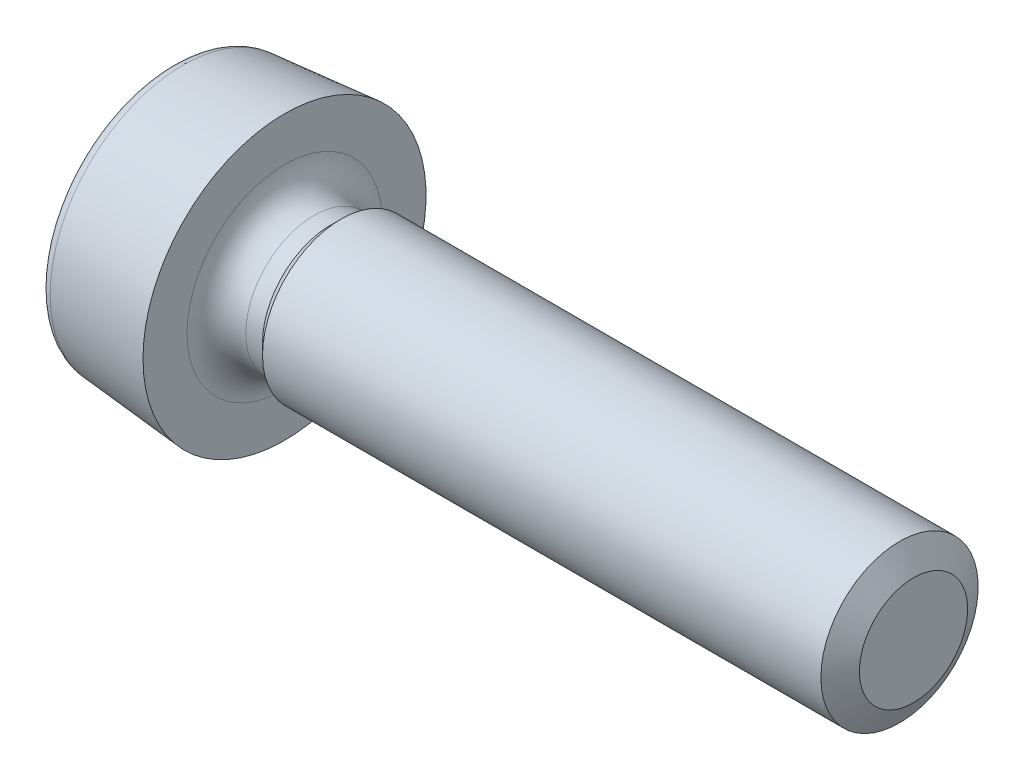
from build123d import *

# Parameters (mm, degrees)
PATTERN_CIRCULAR_1_COUNT = 2
PATTERN_CIRCULAR_1_ANGLE = 90


with BuildPart() as part:
    # 草图3 → Revolve 850 (revolve)
    with BuildSketch(Plane.XY, mode=Mode.PRIVATE) as revolve_850_sk:
        with BuildLine():
            Line((0, 0), (11.8, 0))
            Line((11.8, 0), (11.8, 1.25))
            Line((11.8, 1.25), (2.7, 1.25))
            Line((2.7, 1.25), (2.5325, 1.0825))
            Line((2.5325, 1.0825), (2.2675, 1.0825))
            ThreePointArc((2.2675, 1.0825), (1.93692758, 1.21942758), (1.8, 1.55))
            Line((1.8, 1.55), (1.8, 2.25))
            Line((1.8, 2.25), (0.182568851, 2.10849311))
            ThreePointArc((0.182568851, 2.10849311), (0.052544533, 2.044372212), (0, 1.909254171))
            Line((0, 1.909254171), (0, 0))
        make_face()
    revolve(revolve_850_sk.sketch.rotate(Axis((-2.16958059, 0, 0), (1, 0, 0)), 90), axis=Axis((-2.16958059, 0, 0), (1, 0, 0)))

    # 草图4 → 切除-旋转1 (revolve, cut)
    with BuildSketch(Plane.XY, mode=Mode.PRIVATE) as cut_revolve_1_sk:
        Polygon((11.577437203, 1.25), (12.027437203, 1.25), (11.8, 0.8603), align=None)
    revolve(cut_revolve_1_sk.sketch.rotate(Axis((-0.21798541, 0, 0), (1, 0, 0)), 90), axis=Axis((-0.21798541, 0, 0), (1, 0, 0)), mode=Mode.SUBTRACT)

    # 草图5 → 切除-放样1 section 0
    with BuildSketch(Plane.ZY, mode=Mode.PRIVATE) as loft_1_s0:
        with BuildLine():
            Line((-0.225, 1.35), (0.225, 1.35))
            Line((0.225, 1.35), (0.225, -1.35))
            Line((0.225, -1.35), (-0.225, -1.35))
            Line((-0.225, -1.35), (-0.225, 1.35))
        make_face()
    loft_1 = loft([loft_1_s0.sketch, Vertex(1.2, 0, 0)], mode=Mode.SUBTRACT)

    # 阵列(圆周)1: 切除-放样1 ×2 about axis
    pattern_circular_1_axis = Axis((0, 0, 0), (1, 0, 0))
    for i in range(1, PATTERN_CIRCULAR_1_COUNT):
        add(loft_1.rotate(pattern_circular_1_axis, i * PATTERN_CIRCULAR_1_ANGLE / (PATTERN_CIRCULAR_1_COUNT - 1)), mode=Mode.SUBTRACT)


solid = part.part
